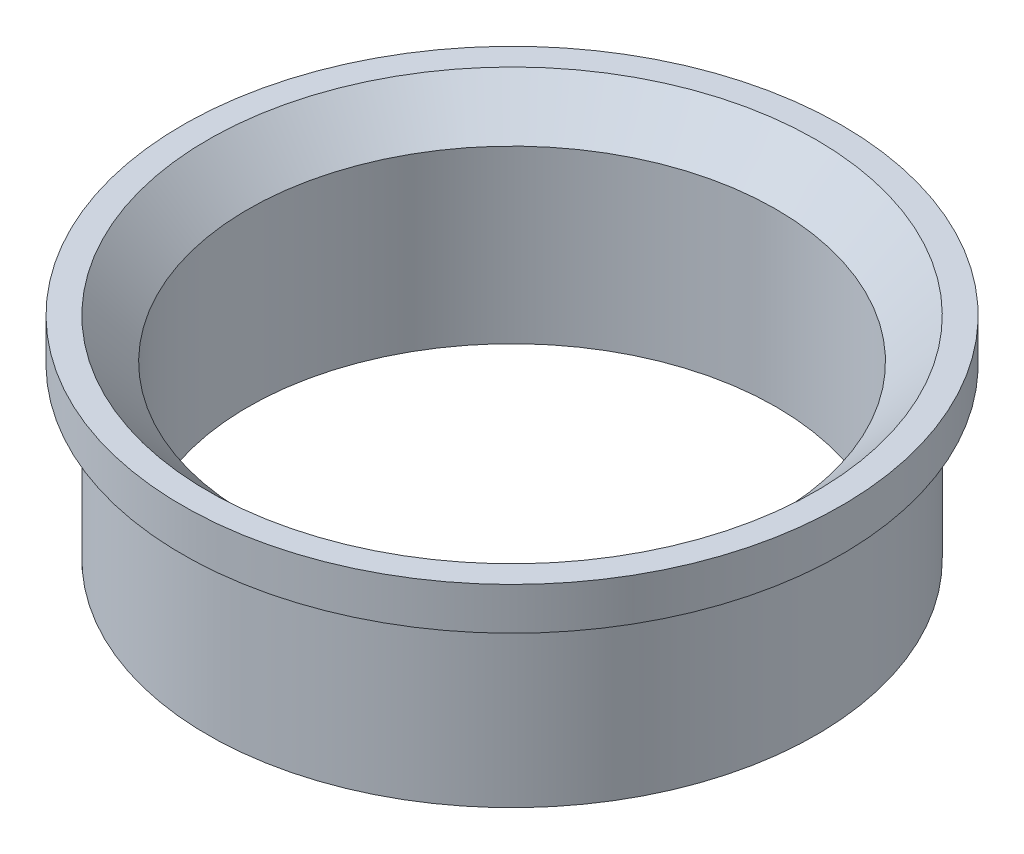
from build123d import *


with BuildPart() as part:
    # Sketch1 → Revolve1 (revolve)
    with BuildSketch(Plane.XY, mode=Mode.PRIVATE) as revolve1_sk:
        Polygon((-62.5, 0), (-62.5, 40.5), (-72, 50), (-78, 50), (-78, 40), (-72, 40), (-72, 0), align=None)
    revolve(revolve1_sk.sketch.rotate(Axis((0, 0, 0), (0, 1, 0)), 270), axis=Axis((0, 0, 0), (0, 1, 0)))


solid = part.part
